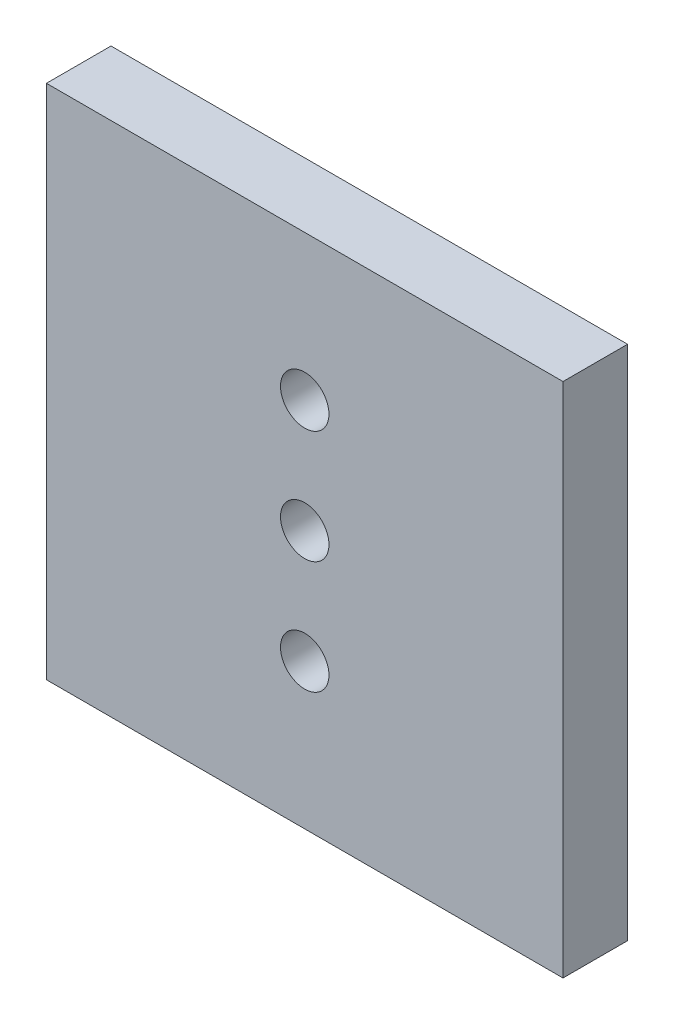
from build123d import *

# Parameters (mm, degrees)
SKETCH1_W           = 64
SKETCH1_H           = 64
BOSS_EXTRUDE1_DEPTH = 8
SKETCH2_R           = 3
CUT_EXTRUDE1_DEPTH  = 28
SKETCH3_R           = 3
CUT_EXTRUDE2_DEPTH  = 28
SKETCH4_R           = 3
CUT_EXTRUDE3_DEPTH  = 28


with BuildPart() as part:
    # Sketch1 → Boss-Extrude1 (new body)
    with BuildSketch(Plane.XY.offset(300)):
        with Locations((300, 300)):
            Rectangle(SKETCH1_W, SKETCH1_H)
    extrude(amount=BOSS_EXTRUDE1_DEPTH)

    # Sketch2 → Cut-Extrude1 (cut)
    with BuildSketch(Plane.XY.offset(308)):
        with Locations((300, 300)):
            Circle(SKETCH2_R)
    extrude(amount=-CUT_EXTRUDE1_DEPTH, mode=Mode.SUBTRACT)

    # Sketch3 → Cut-Extrude2 (cut)
    with BuildSketch(Plane.XY.offset(308)):
        with Locations((300, 314)):
            Circle(SKETCH3_R)
    extrude(amount=-CUT_EXTRUDE2_DEPTH, mode=Mode.SUBTRACT)

    # Sketch4 → Cut-Extrude3 (cut)
    with BuildSketch(Plane.XY.offset(308)):
        with Locations((300, 286)):
            Circle(SKETCH4_R)
    extrude(amount=-CUT_EXTRUDE3_DEPTH, mode=Mode.SUBTRACT)


solid = part.part
